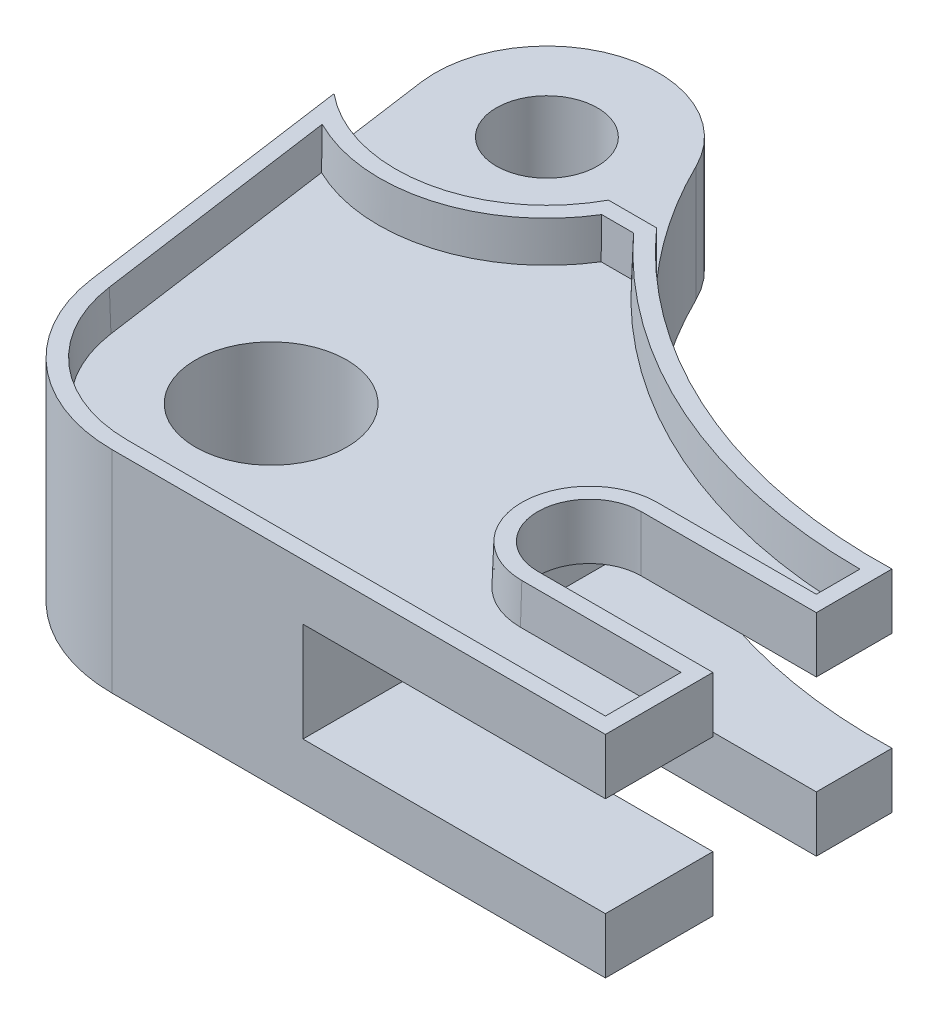
from build123d import *

# Parameters (mm, degrees)
SKETCH1_R               = 9.5
SKETCH1_R_2             = 6.35
BOSS_EXTRUDE1_DEPTH     = 13.25
SKETCH2_W               = 73.338944958
SKETCH2_H               = 12.5
CUT_EXTRUDE3_DEPTH      = 38
CUT_EXTRUDE5_DEPTH      = 124.21282036
CUT_EXTRUDE5_DEPTH_BACK = 6
CUT_EXTRUDE6_DEPTH      = 124.21282036
CUT_EXTRUDE6_DEPTH_BACK = 6
CUT_EXTRUDE8_DEPTH      = 5
CUT_EXTRUDE8_DRAFT      = -2
MIRROR8_COPY_1_DEPTH    = 5
MIRROR8_COPY_1_DRAFT    = -2


with BuildPart() as part:
    # Sketch1 → Boss-Extrude1 (new, symmetric)
    with BuildSketch(Plane(origin=(0, 0, 0), x_dir=(1, 0, 0), z_dir=(0, 1, 0))):
        with BuildLine():
            Line((0, 0), (-62, 0))
            ThreePointArc((-62, 0), (-75.125587601, 4.90964049), (-81.806983567, 17.228104986))
            Line((-81.806983567, 17.228104986), (-88.547021707, 65.390038979))
            ThreePointArc((-88.547021707, 65.390038979), (-78.78369233, 80.716074763), (-62.110282709, 73.49060696))
            ThreePointArc((-62.110282709, 73.49060696), (-36.56849942, 45.611382856), (0, 36))
            Line((0, 36), (0, 26.5))
            Line((0, 26.5), (-22, 26.5))
            ThreePointArc((-22, 26.5), (-28.5, 20), (-22, 13.5))
            Line((-22, 13.5), (0, 13.5))
            Line((0, 13.5), (0, 0))
        make_face()
        with Locations(Location((-62, 20, 0), (0, 0, 270))):
            Circle(SKETCH1_R, mode=Mode.SUBTRACT)
        with Locations(Location((-74.68213321, 67.330365488, 0), (0, 0, 270))):
            Circle(SKETCH1_R_2, mode=Mode.SUBTRACT)
    extrude(amount=BOSS_EXTRUDE1_DEPTH, both=True)

    # Sketch2 → Cut-Extrude3 (cut)
    with BuildSketch(Plane(origin=(0, 0, 0), x_dir=(0, 0, -1), z_dir=(1, 0, 0))):
        with Locations((36.669472479, 0)):
            Rectangle(SKETCH2_W, SKETCH2_H)
    extrude(amount=-CUT_EXTRUDE3_DEPTH, mode=Mode.SUBTRACT)

    # Sketch3 → Cut-Extrude5 (cut, two sides: drawn at the far end of the back side and taken through both)
    with BuildSketch(Plane(origin=(0, 13.25, 0), x_dir=(1, 0, 0), z_dir=(0, 1, 0)).offset(-CUT_EXTRUDE5_DEPTH_BACK)):
        with BuildLine():
            Line((-251.132551902, 188.14493361), (-86.7667399, 52.668773448))
            ThreePointArc((-86.7667399, 52.668773448), (-71.019379836, 48.686754311), (-57.948932679, 58.330365488))
            Line((-57.948932679, 58.330365488), (-51.906439966, 58.330365488))
            Line((-51.906439966, 58.330365488), (161.095696471, 58.330365488))
            Line((161.095696471, 58.330365488), (289.053745356, 464.663207174))
            Line((289.053745356, 464.663207174), (-123.174503017, 594.477775296))
            Line((-123.174503017, 594.477775296), (-251.132551902, 188.14493361))
        make_face()
    extrude(amount=CUT_EXTRUDE5_DEPTH + CUT_EXTRUDE5_DEPTH_BACK, mode=Mode.SUBTRACT)

    # Sketch4 → Cut-Extrude6 (cut, two sides: drawn at the far end of the back side and taken through both)
    with BuildSketch(Plane.XZ.offset(13.25).offset(-CUT_EXTRUDE6_DEPTH_BACK)):
        with BuildLine():
            Line((-251.132551902, -188.14493361), (-86.7667399, -52.668773448))
            ThreePointArc((-86.7667399, -52.668773448), (-71.019379836, -48.686754311), (-57.948932679, -58.330365488))
            Line((-57.948932679, -58.330365488), (-51.906439966, -58.330365488))
            Line((-51.906439966, -58.330365488), (161.095696471, -58.330365488))
            Line((161.095696471, -58.330365488), (289.053745356, -464.663207174))
            Line((289.053745356, -464.663207174), (-123.174503017, -594.477775296))
            Line((-123.174503017, -594.477775296), (-251.132551902, -188.14493361))
        make_face()
    extrude(amount=CUT_EXTRUDE6_DEPTH + CUT_EXTRUDE6_DEPTH_BACK, mode=Mode.SUBTRACT)


with BuildPart() as cut_extrude8_tool:
    # Sketch6 → Cut-Extrude8 (with draft: the straight prism first)
    with BuildSketch(Plane(origin=(0, 13.25, 0), x_dir=(1, 0, 0), z_dir=(0, 1, 0))):
        with BuildLine():
            Line((-2, 28.5), (-2, 33.971784495))
            ThreePointArc((-2, 33.971784495), (-29.743751646, 39.819333442), (-52.793597737, 56.330365488))
            Line((-52.793597737, 56.330365488), (-56.79358939, 56.330365488))
            ThreePointArc((-56.79358939, 56.330365488), (-68.976857381, 47.120223784), (-84.177824667, 48.599859789))
            Line((-84.177824667, 48.599859789), (-79.826285211, 17.505294488))
            ThreePointArc((-79.826285211, 17.505294488), (-73.813028841, 6.418676441), (-62, 2))
            Line((-62, 2), (-2, 2))
            Line((-2, 2), (-2, 11.5))
            Line((-2, 11.5), (-22, 11.5))
            ThreePointArc((-22, 11.5), (-30.5, 20), (-22, 28.5))
            Line((-22, 28.5), (-2, 28.5))
        make_face()
    extrude(amount=-CUT_EXTRUDE8_DEPTH)
    # Cut-Extrude8: the draft: its side faces are tilted about the plane it starts from
    cut_extrude8_sides = [cut_extrude8_tool.faces().sort_by_distance(p)[0] for p in [
        (-12, 10.75, -28.5),
        (-2, 10.75, -31.235892247),
        (-29.743751646, 10.75, -39.819333442),
        (-54.793593564, 10.75, -56.330365488),
        (-68.976857381, 10.75, -47.120223784),
        (-82.002054939, 10.75, -33.052577138),
        (-73.813028841, 10.75, -6.418676441),
        (-32, 10.75, -2),
        (-2, 10.75, -6.75),
        (-12, 10.75, -11.5),
        (-30.5, 10.75, -20),
    ]]
    draft(cut_extrude8_sides, Plane(origin=(0, 13.25, 0), x_dir=(1, 0, 0), z_dir=(0, 1, 0)), CUT_EXTRUDE8_DRAFT)


with BuildPart() as part_1:
    add(part.part)

    # Cut-Extrude8: cut by cut_extrude8_tool
    add(cut_extrude8_tool.part, mode=Mode.SUBTRACT)


with BuildPart() as mirror8_copy_1_tool:
    # Mirror8 copy 1 sketch → Mirror8 copy 1 (with draft: the straight prism first)
    with BuildSketch(Plane.XZ.offset(13.25)):
        with BuildLine():
            Line((-2, -28.5), (-2, -33.971784495))
            ThreePointArc((-2, -33.971784495), (-29.743751646, -39.819333442), (-52.793597737, -56.330365488))
            Line((-52.793597737, -56.330365488), (-56.79358939, -56.330365488))
            ThreePointArc((-56.79358939, -56.330365488), (-68.976857381, -47.120223784), (-84.177824667, -48.599859789))
            Line((-84.177824667, -48.599859789), (-79.826285211, -17.505294488))
            ThreePointArc((-79.826285211, -17.505294488), (-73.813028841, -6.418676441), (-62, -2))
            Line((-62, -2), (-2, -2))
            Line((-2, -2), (-2, -11.5))
            Line((-2, -11.5), (-22, -11.5))
            ThreePointArc((-22, -11.5), (-30.5, -20), (-22, -28.5))
            Line((-22, -28.5), (-2, -28.5))
        make_face()
    extrude(amount=-MIRROR8_COPY_1_DEPTH)
    # Mirror8 copy 1: the draft: its side faces are tilted about the plane it starts from
    mirror8_copy_1_sides = [mirror8_copy_1_tool.faces().sort_by_distance(p)[0] for p in [
        (-12, -10.75, -28.5),
        (-2, -10.75, -31.235892247),
        (-29.743751646, -10.75, -39.819333442),
        (-54.793593564, -10.75, -56.330365488),
        (-68.976857381, -10.75, -47.120223784),
        (-82.002054939, -10.75, -33.052577138),
        (-73.813028841, -10.75, -6.418676441),
        (-32, -10.75, -2),
        (-2, -10.75, -6.75),
        (-12, -10.75, -11.5),
        (-30.5, -10.75, -20),
    ]]
    draft(mirror8_copy_1_sides, Plane.XZ.offset(13.25), MIRROR8_COPY_1_DRAFT)


with BuildPart() as part_2:
    add(part_1.part)

    # Mirror8 copy 1: cut by mirror8_copy_1_tool
    add(mirror8_copy_1_tool.part, mode=Mode.SUBTRACT)


solid = part_2.part
